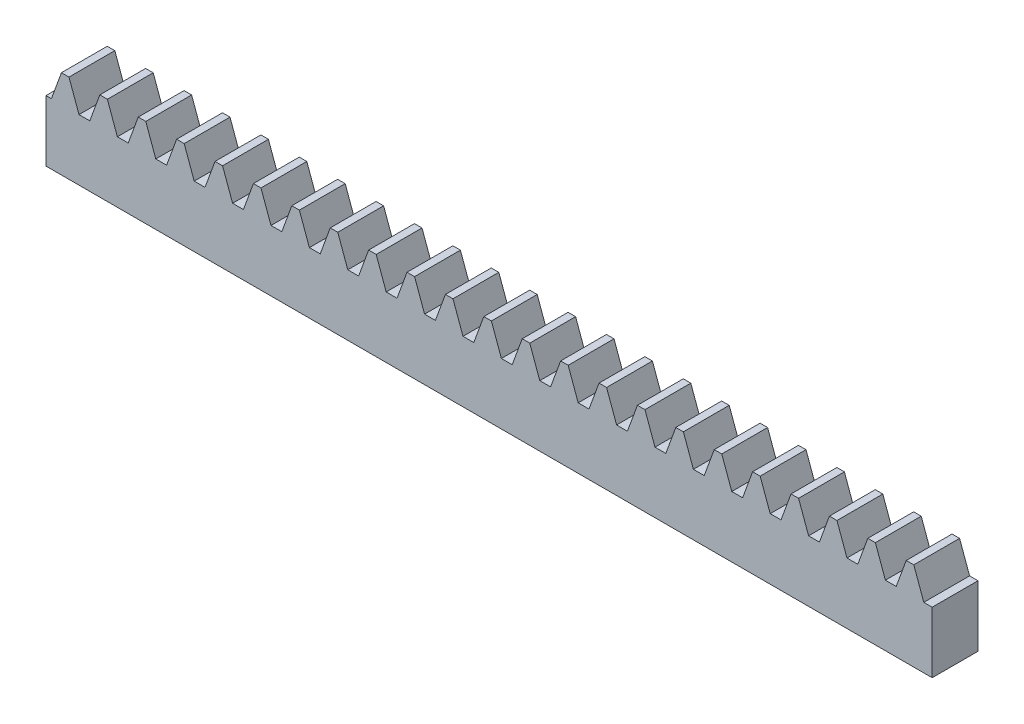
from build123d import *

# Parameters (mm, degrees)
BLANKSKE_W        = 58
BLANKSKE_H        = 5.8
BLANK_DEPTH       = 3
TOOTHCUTSIM_DEPTH = 59.366428707
TEETHCUTS_COUNT   = 25
TEETHCUTS_PITCH   = 2.51327412


with BuildPart() as part:
    # BlankSke → Blank (new body)
    with BuildSketch(Plane.XY):
        with Locations((29, 2.9)):
            Rectangle(BLANKSKE_W, BLANKSKE_H)
    extrude(amount=-BLANK_DEPTH)

    # TooCutSkeSim → ToothCutSim (cut, through all)
    with BuildSketch(Plane.XY):
        Polygon((0.354348296, 4), (-0.354348296, 4), (-1.018739561, 5.8254), (1.018739561, 5.8254), align=None)
    toothcutsim = extrude(amount=-TOOTHCUTSIM_DEPTH, mode=Mode.SUBTRACT)

    # TeethCuts: ToothCutSim ×25
    with Locations(*[(i * TEETHCUTS_PITCH, 0, 0) for i in range(1, TEETHCUTS_COUNT)]):
        add(toothcutsim, mode=Mode.SUBTRACT)


solid = part.part
